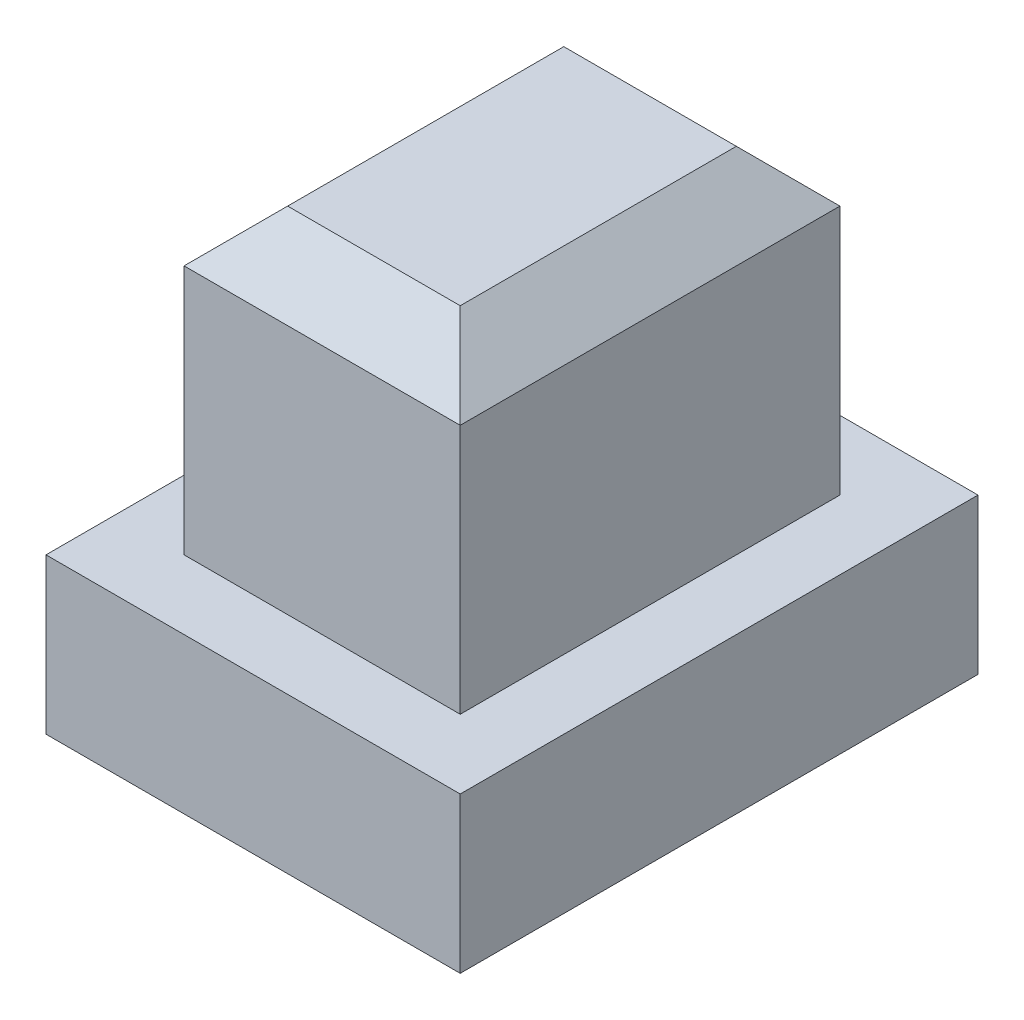
from build123d import *

# Parameters (mm, degrees)
SKETCH_1_W      = 4.8
SKETCH_1_H      = 6
EXTRUDE_1_DEPTH = 1.8
SKETCH_2_W      = 3.2
SKETCH_2_H      = 4.4
EXTRUDE_2_DEPTH = 3.5
CHAMFER_1_SIZE  = 0.6


with BuildPart() as part:
    # 草图1 → 凸台-拉伸1 (new body)
    with BuildSketch(Plane(origin=(0, 0, 0), x_dir=(1, 0, 0), z_dir=(0, 1, 0))):
        with Locations((2.187378641, 1.04368932)):
            Rectangle(SKETCH_1_W, SKETCH_1_H)
    extrude(amount=EXTRUDE_1_DEPTH)

    # 草图2 → 凸台-拉伸2 (add)
    with BuildSketch(Plane(origin=(0, 1.8, 0), x_dir=(1, 0, 0), z_dir=(0, 1, 0))):
        with Locations((2.187378641, 1.04368932)):
            Rectangle(SKETCH_2_W, SKETCH_2_H)
    extrude(amount=EXTRUDE_2_DEPTH)

    # 倒角1
    chamfer_1_edges = [part.edges().sort_by_distance(p)[0] for p in [
        (2.187378641, 5.3, -3.24368932),
        (0.587378641, 5.3, -1.04368932),
        (2.187378641, 5.3, 1.15631068),
        (3.787378641, 5.3, -1.04368932),
    ]]
    chamfer(chamfer_1_edges, length=CHAMFER_1_SIZE)


solid = part.part
